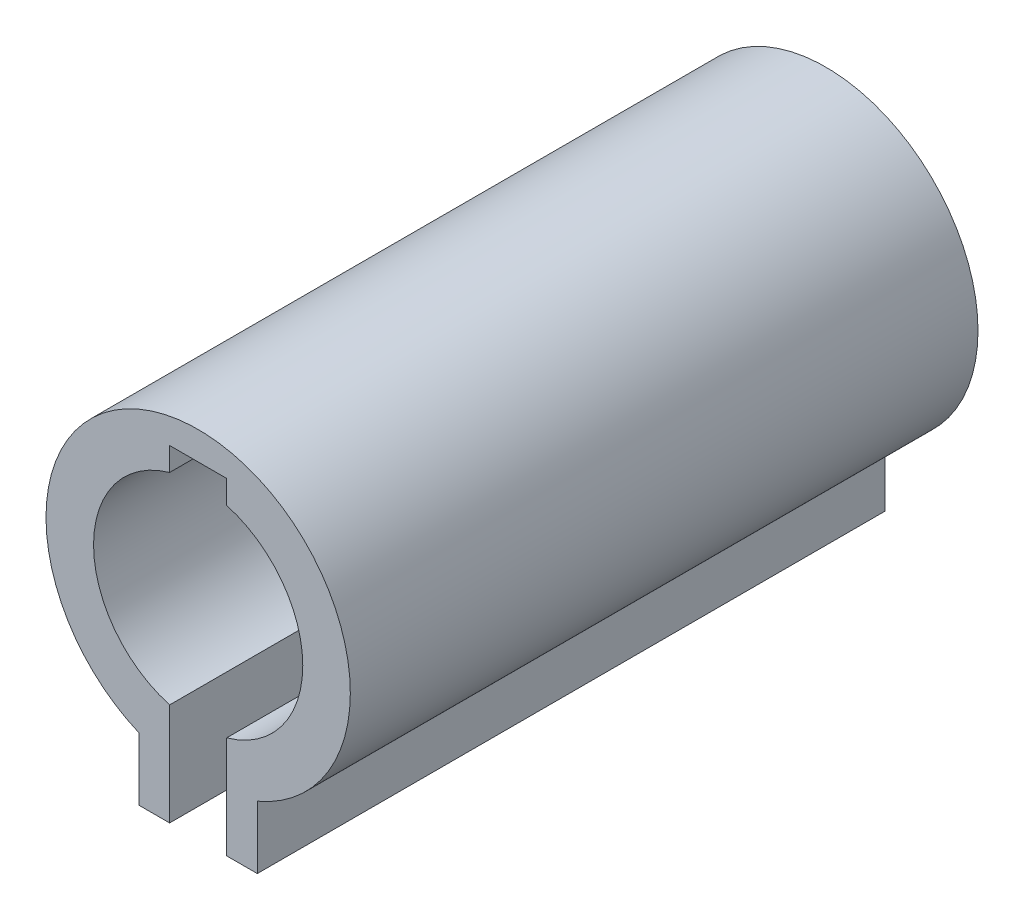
from build123d import *

# Parameters (mm, degrees)
BOSS_EXTRUDE1_DEPTH      = 33
BOSS_EXTRUDE1_DEPTH_BACK = 33
SKETCH1_R                = 16
SKETCH1_R_2              = 11
CUT_EXTRUDE1_DEPTH       = 33
BOSS_EXTRUDE2_DEPTH      = 66
CUT_EXTRUDE4_DEPTH       = 72.18434857


with BuildPart() as part:
    # Sketch1 → Boss-Extrude1 (new, two sides: drawn at the far end of the back side and taken through both)
    with BuildSketch(Plane.XY.offset(-BOSS_EXTRUDE1_DEPTH_BACK)):
        Circle(SKETCH1_R)
        Circle(SKETCH1_R_2, mode=Mode.SUBTRACT)
    extrude(amount=BOSS_EXTRUDE1_DEPTH + BOSS_EXTRUDE1_DEPTH_BACK)

    # Sketch2 → Cut-Extrude1 (cut)
    with BuildSketch(Plane.XY.offset(33)):
        with BuildLine():
            Line((-3, 10.540195713), (-3, 13.040195713))
            Line((-3, 13.040195713), (0, 13.040195713))
            Line((0, 13.040195713), (3, 13.040195713))
            Line((3, 13.040195713), (3, 10.540195713))
            ThreePointArc((3, 10.540195713), (0, 10.958819538), (-3, 10.540195713))
        make_face()
    cut_extrude1 = extrude(amount=-CUT_EXTRUDE1_DEPTH, mode=Mode.SUBTRACT)

    # Mirror2: Cut-Extrude1 across plane
    add(cut_extrude1.mirror(Plane(origin=(0, 0, 0), x_dir=(1, 0, 0), z_dir=(0, 0, -1))), mode=Mode.SUBTRACT)

    # Sketch3 → Boss-Extrude2 (add, through all)
    with BuildSketch(Plane.XY.offset(33)):
        with BuildLine():
            Line((-3, -21.335685631), (-3, -15.716233646))
            ThreePointArc((-3, -15.716233646), (-4.63488117, -15.31397651), (-6.218441038, -14.74215015))
            Line((-6.218441038, -14.74215015), (-6.218441038, -21.335685631))
            Line((-6.218441038, -21.335685631), (-3, -21.335685631))
        make_face()
        with BuildLine():
            ThreePointArc((6.218441038, -14.74215015), (4.63488117, -15.31397651), (3, -15.716233646))
            Line((3, -15.716233646), (3, -21.335685631))
            Line((3, -21.335685631), (6.218441038, -21.335685631))
            Line((6.218441038, -21.335685631), (6.218441038, -14.74215015))
        make_face()
    extrude(amount=-BOSS_EXTRUDE2_DEPTH)

    # Sketch4 → Cut-Extrude4 (cut, through all)
    with BuildSketch(Plane.XY.offset(33)):
        Polygon((-3, -10.583005244), (-3, -16.271539673), (3, -16.271539673), (3, -15.716233646), (3, -10.583005244), align=None)
    extrude(amount=-CUT_EXTRUDE4_DEPTH, mode=Mode.SUBTRACT)


solid = part.part
